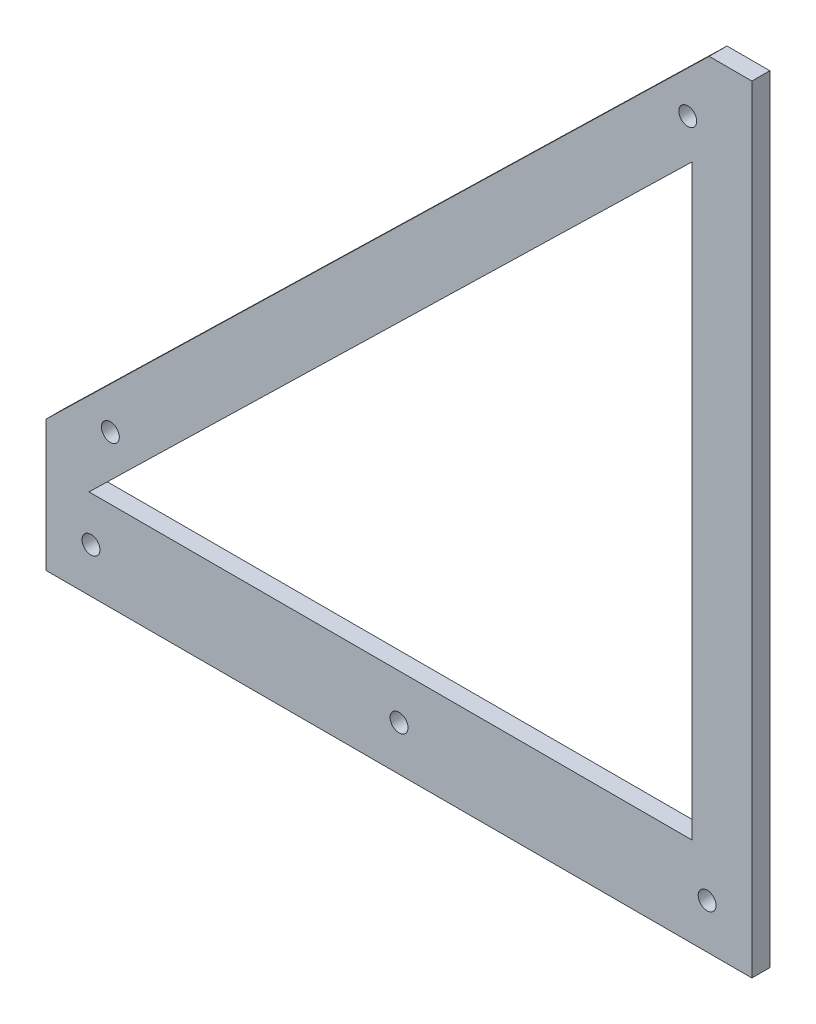
from build123d import *

# Parameters (mm, degrees)
SKETCH2_R           = 1.5
BOSS_EXTRUDE1_DEPTH = 3


with BuildPart() as part:
    # Sketch2 → Boss-Extrude1 (new body)
    with BuildSketch(Plane.XY):
        Polygon((0, 6.979195336), (0, -15), (118.208469634, -15), (118.208469634, 115.11627907), (111.041802967, 115.11627907), align=None)
        Polygon((108.208469634, 0), (7.166666667, 0), (108.208469634, 98.398671636), align=None, mode=Mode.SUBTRACT)
        with Locations((107.462245122, 104.651162791)):
            Circle(SKETCH2_R, mode=Mode.SUBTRACT)
        with Locations((10.746224512, 10.465116279)):
            Circle(SKETCH2_R, mode=Mode.SUBTRACT)
        with Locations((110.708469634, -7.5)):
            Circle(SKETCH2_R, mode=Mode.SUBTRACT)
        with Locations((7.5, -7.5)):
            Circle(SKETCH2_R, mode=Mode.SUBTRACT)
        with Locations((59.104234817, -7.5)):
            Circle(SKETCH2_R, mode=Mode.SUBTRACT)
    extrude(amount=BOSS_EXTRUDE1_DEPTH)


solid = part.part
